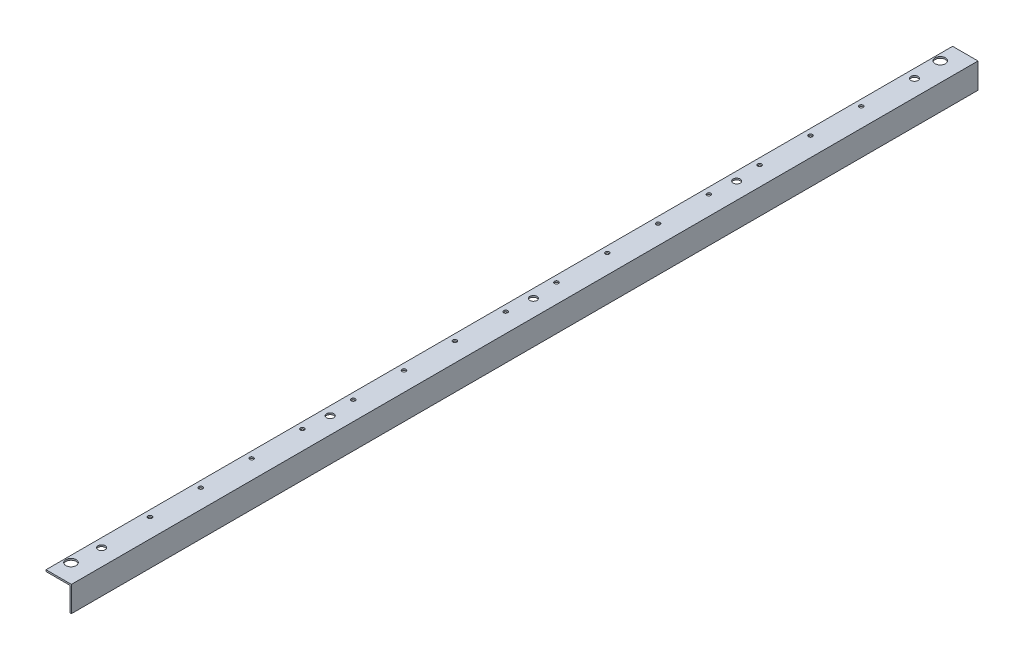
from build123d import *

# Parameters (mm, degrees)
BOSS_EXTRUDE1_DEPTH = 1812.925
SKETCH2_R           = 10.31875
SKETCH2_R_2         = 7.14375
CUT_EXTRUDE1_DEPTH  = 1815.347909202
SKETCH4_R           = 3.96875
CUT_EXTRUDE3_DEPTH  = 44.45
LPATTERN1_COUNT     = 15
LPATTERN1_PITCH     = 101.6


with BuildPart() as part:
    # Sketch1 → Boss-Extrude1 (new body)
    with BuildSketch(Plane.XY):
        Polygon((0, 0), (-50.8, 0), (-50.8, -3.175), (-3.175, -3.175), (-3.175, -50.8), (0, -50.8), align=None)
    extrude(amount=BOSS_EXTRUDE1_DEPTH)

    # Sketch2 → Cut-Extrude1 (cut, through all)
    with BuildSketch(Plane(origin=(0, 0, 0), x_dir=(1, 0, 0), z_dir=(0, 1, 0))):
        with Locations(Location((-38.1, -37.30625, 0), (0, 0, 270))):
            Circle(SKETCH2_R)
        with Locations(Location((-38.1, -1775.61875, 0), (0, 0, 270))):
            Circle(SKETCH2_R)
        with Locations(Location((-33.3375, -93.6625, 0), (0, 0, 270))):
            Circle(SKETCH2_R_2)
        with Locations(Location((-33.3375, -449.2625, 0), (0, 0, 270))):
            Circle(SKETCH2_R_2)
        with Locations(Location((-33.3375, -855.6625, 0), (0, 0, 270))):
            Circle(SKETCH2_R_2)
        with Locations(Location((-33.3375, -1262.0625, 0), (0, 0, 270))):
            Circle(SKETCH2_R_2)
        with Locations(Location((-33.3375, -1719.2625, 0), (0, 0, 270))):
            Circle(SKETCH2_R_2)
    extrude(amount=-CUT_EXTRUDE1_DEPTH, mode=Mode.SUBTRACT)

    # Sketch4 → Cut-Extrude3 (cut)
    with BuildSketch(Plane(origin=(-2.029899632, 0, 893.163272881), x_dir=(1, 0, 0), z_dir=(0, 1, 0))):
        with Locations(Location((-36.070100368, 697.900772881, 0), (0, 0, 270))):
            Circle(SKETCH4_R)
    cut_extrude3 = extrude(amount=-CUT_EXTRUDE3_DEPTH, mode=Mode.SUBTRACT)

    # LPattern1: Cut-Extrude3 ×15
    with Locations(*[(0, 0, i * LPATTERN1_PITCH) for i in range(1, LPATTERN1_COUNT)]):
        add(cut_extrude3, mode=Mode.SUBTRACT)


solid = part.part
